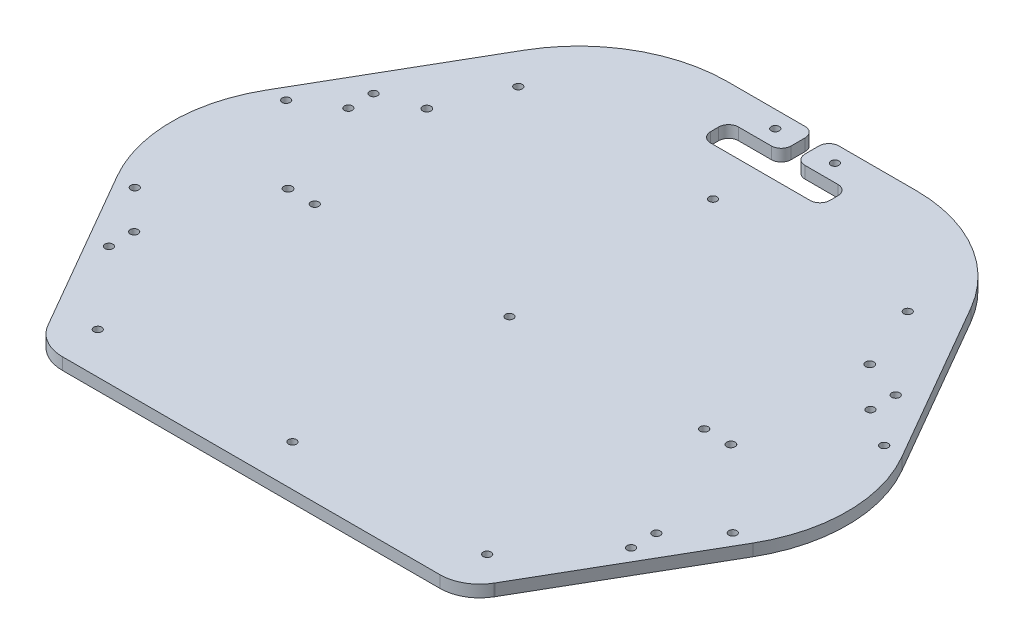
from build123d import *

# Parameters (mm, degrees)
ESBO_O1_R                = 2
ESBO_O1_R_2              = 2.1
RESSALTO_EXTRUS_O1_DEPTH = 6


with BuildPart() as part:
    # Esboço1 → Ressalto-extrusão1 (new body)
    with BuildSketch(Plane(origin=(0, 6, 0), x_dir=(1, 0, 0), z_dir=(0, 1, 0))):
        with BuildLine():
            Line((-94.999273038, -130), (94.999273038, -130))
            ThreePointArc((94.999273038, -130), (104.95780768, -127.344382024), (112.27173596, -120.082758778))
            ThreePointArc((112.27173596, -120.082758778), (112.362006236, -119.927693826), (112.451905284, -119.77241336))
            Line((112.451905284, -119.77241336), (159.951905284, -37.5))
            ThreePointArc((159.951905284, -37.5), (170, 0), (159.951905284, 37.5))
            Line((159.951905284, 37.5), (112.451905284, 119.77241336))
            ThreePointArc((112.451905284, 119.77241336), (85, 147.224318643), (47.5, 157.27241336))
            Line((47.5, 157.27241336), (8.5, 157.27241336))
            ThreePointArc((8.5, 157.27241336), (4.964466094, 155.807947265), (3.5, 152.27241336))
            Line((3.5, 152.27241336), (3.5, 145.27241336))
            ThreePointArc((3.5, 145.27241336), (4.964466094, 141.736879454), (8.5, 140.27241336))
            Line((8.5, 140.27241336), (25, 140.27241336))
            ThreePointArc((25, 140.27241336), (28.535533906, 138.807947265), (30, 135.27241336))
            Line((30, 135.27241336), (30, 131.27241336))
            ThreePointArc((30, 131.27241336), (28.535533906, 127.736879454), (25, 126.27241336))
            Line((25, 126.27241336), (-25, 126.27241336))
            ThreePointArc((-25, 126.27241336), (-28.535533906, 127.736879454), (-30, 131.27241336))
            Line((-30, 131.27241336), (-30, 135.27241336))
            ThreePointArc((-30, 135.27241336), (-28.535533906, 138.807947265), (-25, 140.27241336))
            Line((-25, 140.27241336), (-8.5, 140.27241336))
            ThreePointArc((-8.5, 140.27241336), (-4.964466094, 141.736879454), (-3.5, 145.27241336))
            Line((-3.5, 145.27241336), (-3.5, 152.27241336))
            ThreePointArc((-3.5, 152.27241336), (-4.964466094, 155.807947265), (-8.5, 157.27241336))
            Line((-8.5, 157.27241336), (-47.5, 157.27241336))
            ThreePointArc((-47.5, 157.27241336), (-85, 147.224318643), (-112.451905284, 119.77241336))
            Line((-112.451905284, 119.77241336), (-159.951905284, 37.5))
            ThreePointArc((-159.951905284, 37.5), (-170, 0), (-159.951905284, -37.5))
            Line((-159.951905284, -37.5), (-112.451905284, -119.77241336))
            ThreePointArc((-112.451905284, -119.77241336), (-112.362006236, -119.927693826), (-112.27173596, -120.082758778))
            ThreePointArc((-112.27173596, -120.082758778), (-104.95780768, -127.344382024), (-94.999273038, -130))
        make_face()
        with Locations(Location((150.5, -38.1, 0), (0, 0, 90))):
            Circle(ESBO_O1_R, mode=Mode.SUBTRACT)
        with Locations(Location((150.5, 38.1, 0), (0, 0, 90))):
            Circle(ESBO_O1_R, mode=Mode.SUBTRACT)
        with Locations(Location((-150.5, -38.1, 0), (0, 0, 90))):
            Circle(ESBO_O1_R, mode=Mode.SUBTRACT)
        with Locations(Location((-150.5, 38.1, 0), (0, 0, 90))):
            Circle(ESBO_O1_R, mode=Mode.SUBTRACT)
        with Locations(Location((15, 148.77, 0), (0, 0, 90))):
            Circle(ESBO_O1_R, mode=Mode.SUBTRACT)
        with Locations(Location((-15, 148.77, 0), (0, 0, 90))):
            Circle(ESBO_O1_R, mode=Mode.SUBTRACT)
        with Locations(Location((131.4, -57.5, 0), (0, 0, 90))):
            Circle(ESBO_O1_R, mode=Mode.SUBTRACT)
        with Locations(Location((-131.4, -57.5, 0), (0, 0, 90))):
            Circle(ESBO_O1_R, mode=Mode.SUBTRACT)
        with Locations(Location((131.4, 63, 0), (0, 0, 90))):
            Circle(ESBO_O1_R, mode=Mode.SUBTRACT)
        with Locations(Location((-131.4, 63, 0), (0, 0, 90))):
            Circle(ESBO_O1_R, mode=Mode.SUBTRACT)
        with Locations(Location((131.4, -70.2, 0), (0, 0, 90))):
            Circle(ESBO_O1_R, mode=Mode.SUBTRACT)
        with Locations(Location((-131.4, -70.2, 0), (0, 0, 90))):
            Circle(ESBO_O1_R, mode=Mode.SUBTRACT)
        with Locations(Location((131.4, 50.3, 0), (0, 0, 90))):
            Circle(ESBO_O1_R, mode=Mode.SUBTRACT)
        with Locations(Location((-131.4, 50.3, 0), (0, 0, 90))):
            Circle(ESBO_O1_R, mode=Mode.SUBTRACT)
        with Locations(Location((98, -109.22, 0), (0, 0, 90))):
            Circle(ESBO_O1_R, mode=Mode.SUBTRACT)
        with Locations(Location((111.4552, 0, 0), (0, 0, 90))):
            Circle(ESBO_O1_R_2, mode=Mode.SUBTRACT)
        with Locations(Location((111.4552, 69.85, 0), (0, 0, 90))):
            Circle(ESBO_O1_R_2, mode=Mode.SUBTRACT)
        with Locations(Location((-111.4552, 0, 0), (0, 0, 90))):
            Circle(ESBO_O1_R_2, mode=Mode.SUBTRACT)
        with Locations(Location((-111.4552, 69.85, 0), (0, 0, 90))):
            Circle(ESBO_O1_R_2, mode=Mode.SUBTRACT)
        with Locations(Location((-97.9932, 0, 0), (0, 0, 90))):
            Circle(ESBO_O1_R, mode=Mode.SUBTRACT)
        with Locations(Location((97.9932, 0, 0), (0, 0, 90))):
            Circle(ESBO_O1_R, mode=Mode.SUBTRACT)
        with Locations(Location((0, 0, 0), (0, 0, 90))):
            Circle(ESBO_O1_R, mode=Mode.SUBTRACT)
        with Locations(Location((0, -109.22, 0), (0, 0, 90))):
            Circle(ESBO_O1_R, mode=Mode.SUBTRACT)
        with Locations(Location((0, 102.4382, 0), (0, 0, 90))):
            Circle(ESBO_O1_R, mode=Mode.SUBTRACT)
        with Locations(Location((-98, 102.4382, 0), (0, 0, 90))):
            Circle(ESBO_O1_R, mode=Mode.SUBTRACT)
        with Locations(Location((98, 102.4382, 0), (0, 0, 90))):
            Circle(ESBO_O1_R, mode=Mode.SUBTRACT)
        with Locations(Location((-98, -109.22, 0), (0, 0, 90))):
            Circle(ESBO_O1_R, mode=Mode.SUBTRACT)
    extrude(amount=-RESSALTO_EXTRUS_O1_DEPTH)


solid = part.part
